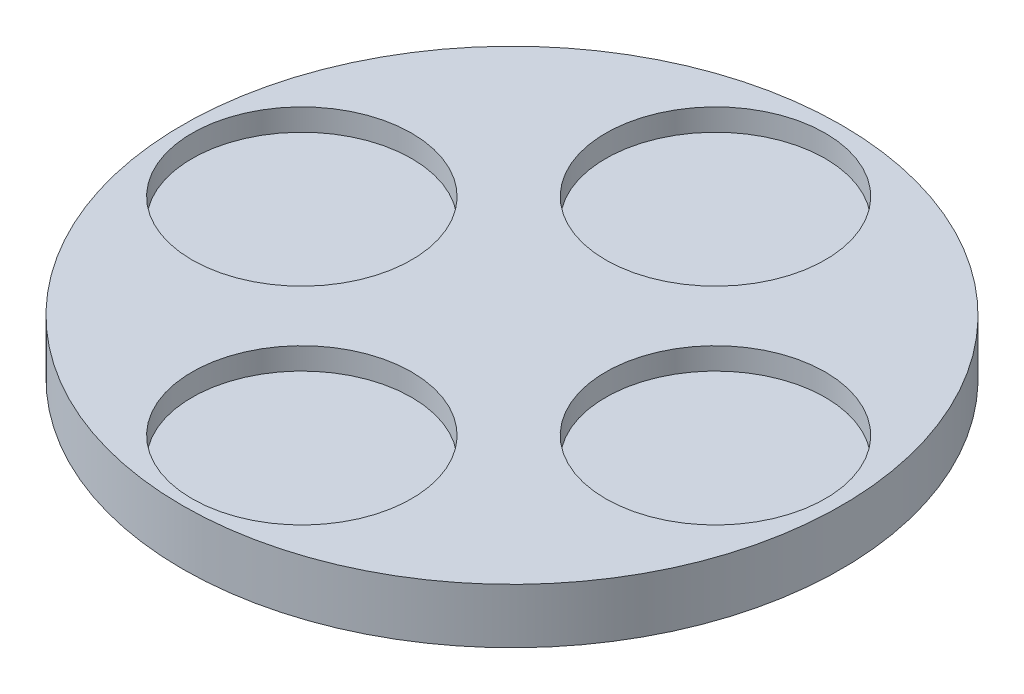
from build123d import *

# Parameters (mm, degrees)
SKETCH1_R           = 76.227284409
BOSS_EXTRUDE1_DEPTH = 12.7
SKETCH5_R           = 25.4
CUT_EXTRUDE2_DEPTH  = 5.08
SKETCH7_R           = 25.4
CUT_EXTRUDE4_DEPTH  = 5.08


with BuildPart() as part:
    # Sketch1 → Boss-Extrude1 (new body)
    with BuildSketch(Plane(origin=(0, 0, 0), x_dir=(1, 0, 0), z_dir=(0, 1, 0))):
        with Locations(Location((0.257754177, 0.515508354, 0), (0, 0, 270))):
            Circle(SKETCH1_R)
    extrude(amount=BOSS_EXTRUDE1_DEPTH)

    # Sketch5 → Cut-Extrude2 (cut)
    with BuildSketch(Plane(origin=(0, 12.7, 0), x_dir=(1, 0, 0), z_dir=(0, 1, 0))):
        with Locations(Location((-47.837919056, 0, 0), (0, 0, 270))):
            Circle(SKETCH5_R)
    extrude(amount=-CUT_EXTRUDE2_DEPTH, mode=Mode.SUBTRACT)

    # Sketch7 → Cut-Extrude4 (cut)
    with BuildSketch(Plane(origin=(0, 12.7, 0), x_dir=(1, 0, 0), z_dir=(0, 1, 0))):
        with Locations(Location((0, 47.837919056, 0), (0, 0, 270))):
            Circle(SKETCH7_R)
        with Locations(Location((47.837919056, 0, 0), (0, 0, 270))):
            Circle(SKETCH7_R)
        with Locations(Location((0, -47.837919056, 0), (0, 0, 270))):
            Circle(SKETCH7_R)
    extrude(amount=-CUT_EXTRUDE4_DEPTH, mode=Mode.SUBTRACT)


solid = part.part
